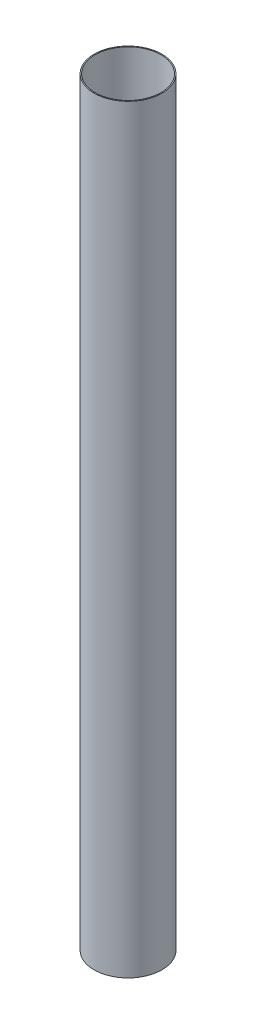
from build123d import *

# Parameters (mm, degrees)
SKETCH2_W = 1143
SKETCH2_H = 1.524


with BuildPart() as part:
    # Sketch2 → Revolve1 (revolve)
    with BuildSketch(Plane(origin=(0, 0, 0), x_dir=(0, 1, 0), z_dir=(0, 0, 1)), mode=Mode.PRIVATE) as revolve1_sk:
        with Locations((1206.5, 50.292)):
            Rectangle(SKETCH2_W, SKETCH2_H)
    revolve(revolve1_sk.sketch.rotate(Axis((0, -88.99, 0), (0, 1, 0)), 270), axis=Axis((0, -88.99, 0), (0, 1, 0)))


solid = part.part
